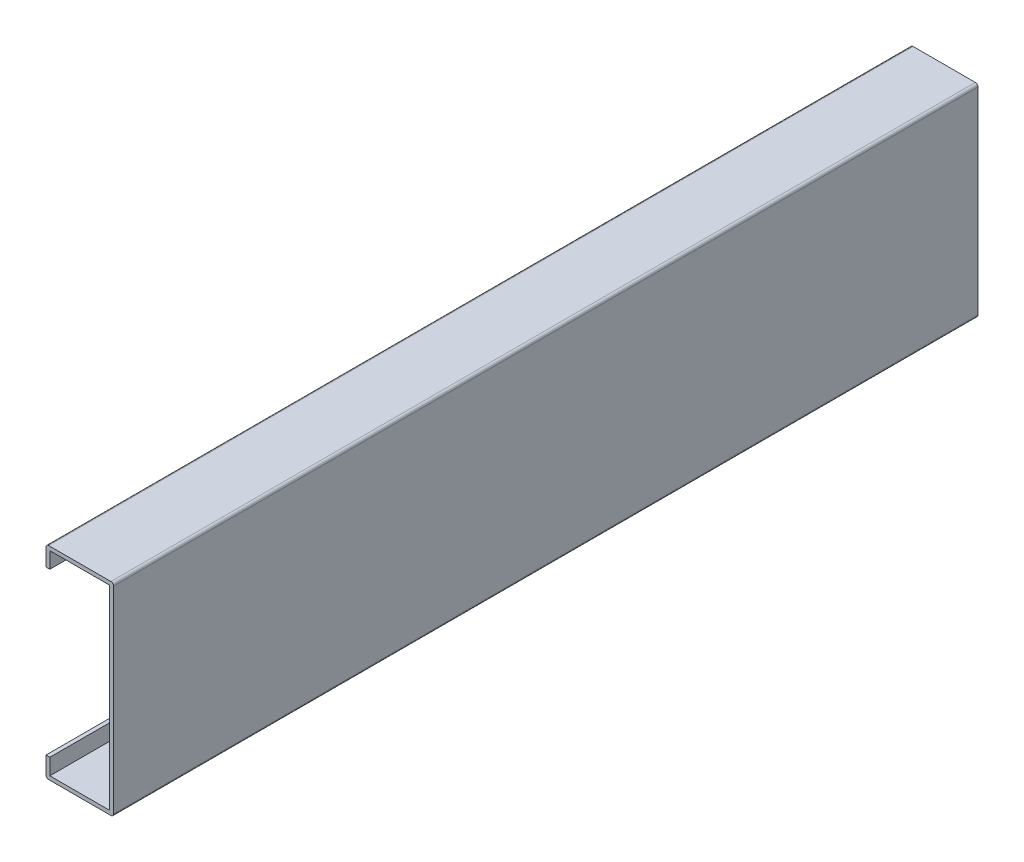
from build123d import *

# Parameters (mm, degrees)
SALIENTE_EXTRUIR1_DEPTH = 650
REDONDEO1_R             = 2


with BuildPart() as part:
    # Croquis1 → Saliente-Extruir1 (new body)
    with BuildSketch(Plane.XY):
        Polygon((0, 0), (50.8, 0), (50.8, -152.4), (0, -152.4), (0, -137.4), (2.9, -137.4), (2.9, -149.5), (47.9, -149.5), (47.9, -2.9), (2.9, -2.9), (2.9, -15), (0, -15), align=None)
    extrude(amount=SALIENTE_EXTRUIR1_DEPTH)

    # Redondeo1
    redondeo1_edges = [part.edges().sort_by_distance(p)[0] for p in [
        (0, 0, 325),
        (50.8, 0, 325),
        (50.8, -152.4, 325),
        (0, -152.4, 325),
    ]]
    fillet(redondeo1_edges, radius=REDONDEO1_R)


solid = part.part
